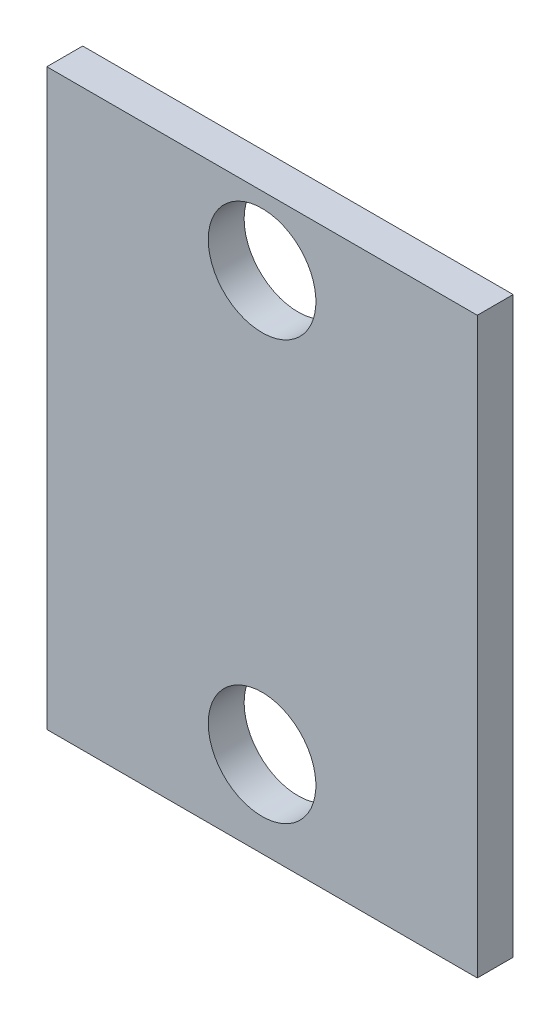
from build123d import *

# Parameters (mm, degrees)
SKETCH1_W                      = 19.05
SKETCH1_H                      = 25.4
BOSS_EXTRUDE1_DEPTH            = 1.5875
F_3_16_0_1875_DIAMETER_HOLE1_D = 4.7625


with BuildPart() as part:
    # Sketch1 → Boss-Extrude1 (new body)
    with BuildSketch(Plane.XY):
        with Locations((9.525, -12.7)):
            Rectangle(SKETCH1_W, SKETCH1_H)
    extrude(amount=BOSS_EXTRUDE1_DEPTH)

    # 3/16 (0.1875) Diameter Hole1 (through all)
    with Locations(Plane(origin=(0, 0, 0), x_dir=(-1, 0, 0), z_dir=(0, 0, -1))):
        with Locations((-9.525, -3.048), (-9.525, -21.59)):
            Hole(F_3_16_0_1875_DIAMETER_HOLE1_D / 2)


solid = part.part
